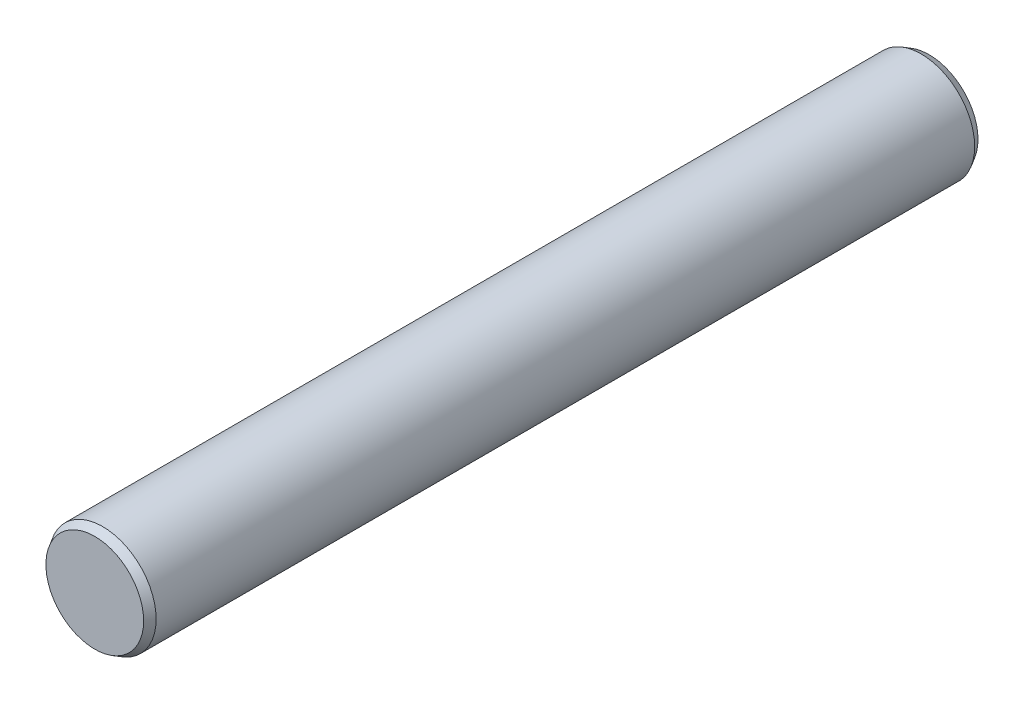
from build123d import *

# Parameters (mm, degrees)
SKETCH2_R      = 1.7145
EXTRUDE1_DEPTH = 13.3858
CHAMFER1_SIZE  = 0.254
CHAMFER1_SIZE2 = 0.146646968
CHAMFER2_SIZE  = 0.254
CHAMFER2_SIZE2 = 0.146646968


with BuildPart() as part:
    # Sketch2 → Extrude1 (new, symmetric)
    with BuildSketch(Plane.XY):
        Circle(SKETCH2_R)
    extrude(amount=EXTRUDE1_DEPTH, both=True)

    # Chamfer1
    chamfer1_edges = [part.edges().sort_by_distance(p)[0] for p in [
        (-1.7145, 0, 13.3858),
    ]]
    chamfer1_side = [part.faces().sort_by_distance(p)[0] for p in [
        (-1.7145, 0, 0),
    ]]
    chamfer(chamfer1_edges, length=CHAMFER1_SIZE, length2=CHAMFER1_SIZE2, reference=chamfer1_side[0])

    # Chamfer2
    chamfer2_edges = [part.edges().sort_by_distance(p)[0] for p in [
        (-1.7145, 0, -13.3858),
    ]]
    chamfer2_side = [part.faces().sort_by_distance(p)[0] for p in [
        (-1.7145, 0, -0.127),
    ]]
    chamfer(chamfer2_edges, length=CHAMFER2_SIZE, length2=CHAMFER2_SIZE2, reference=chamfer2_side[0])


solid = part.part
